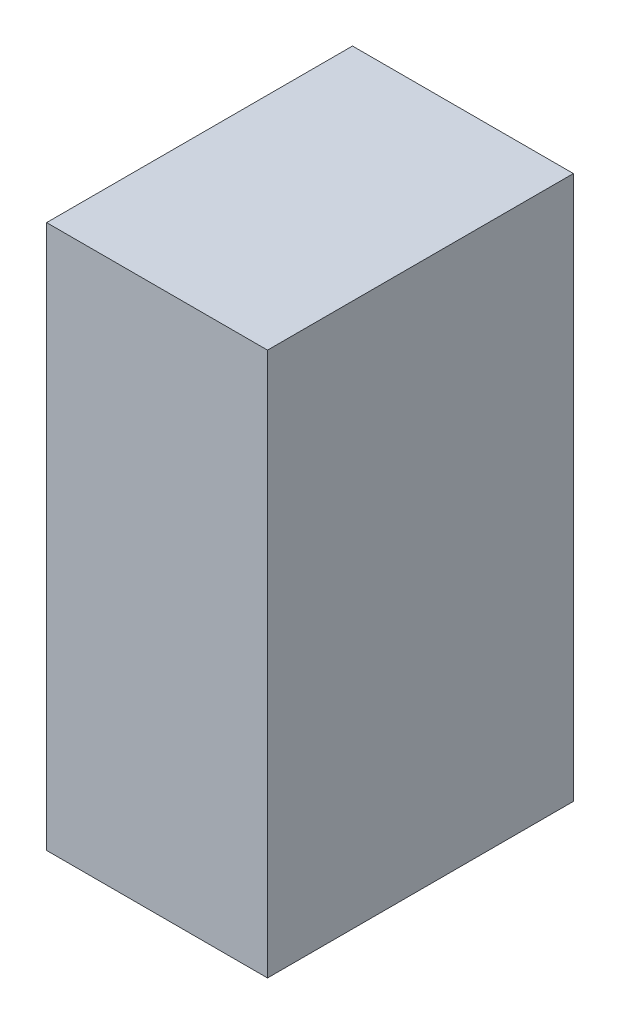
from build123d import *

# Parameters (mm, degrees)
ESBO_O1_W                = 6.5
ESBO_O1_H                = 9
RESSALTO_EXTRUS_O1_DEPTH = 16


with BuildPart() as part:
    # Esboço1 → Ressalto-extrusão1 (new body)
    with BuildSketch(Plane(origin=(0, 0, 0), x_dir=(1, 0, 0), z_dir=(0, 1, 0))):
        with Locations((3.25, 4.5)):
            Rectangle(ESBO_O1_W, ESBO_O1_H)
    extrude(amount=RESSALTO_EXTRUS_O1_DEPTH)


solid = part.part
